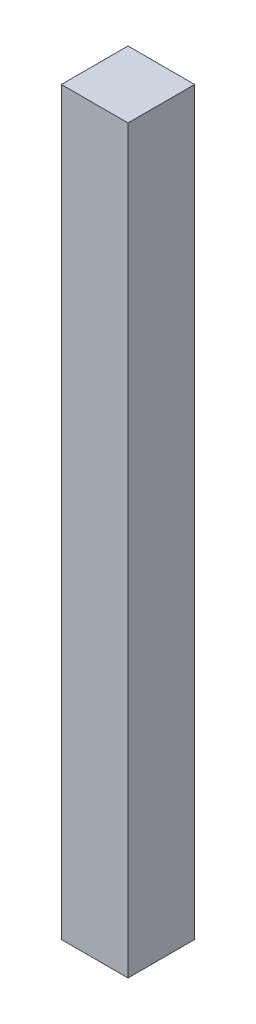
from build123d import *

# Parameters (mm, degrees)
TOPPING_KLAPE_KAT2_GAZLI_AMORTISOR_2_1_START = 8
SKETCH1_W                                    = 18
SKETCH1_H                                    = 200
TOPPING_KLAPE_KAT2_GAZLI_AMORTISOR_2_1_DEPTH = 18


with BuildPart() as part:
    # Sketch1 → TOPPING_klape_kat2_gazli_amortisor_2_1 (new body)
    with BuildSketch(Plane.XY.offset(TOPPING_KLAPE_KAT2_GAZLI_AMORTISOR_2_1_START)):
        with Locations((646, 1280)):
            Rectangle(SKETCH1_W, SKETCH1_H)
    extrude(amount=TOPPING_KLAPE_KAT2_GAZLI_AMORTISOR_2_1_DEPTH)


solid = part.part
